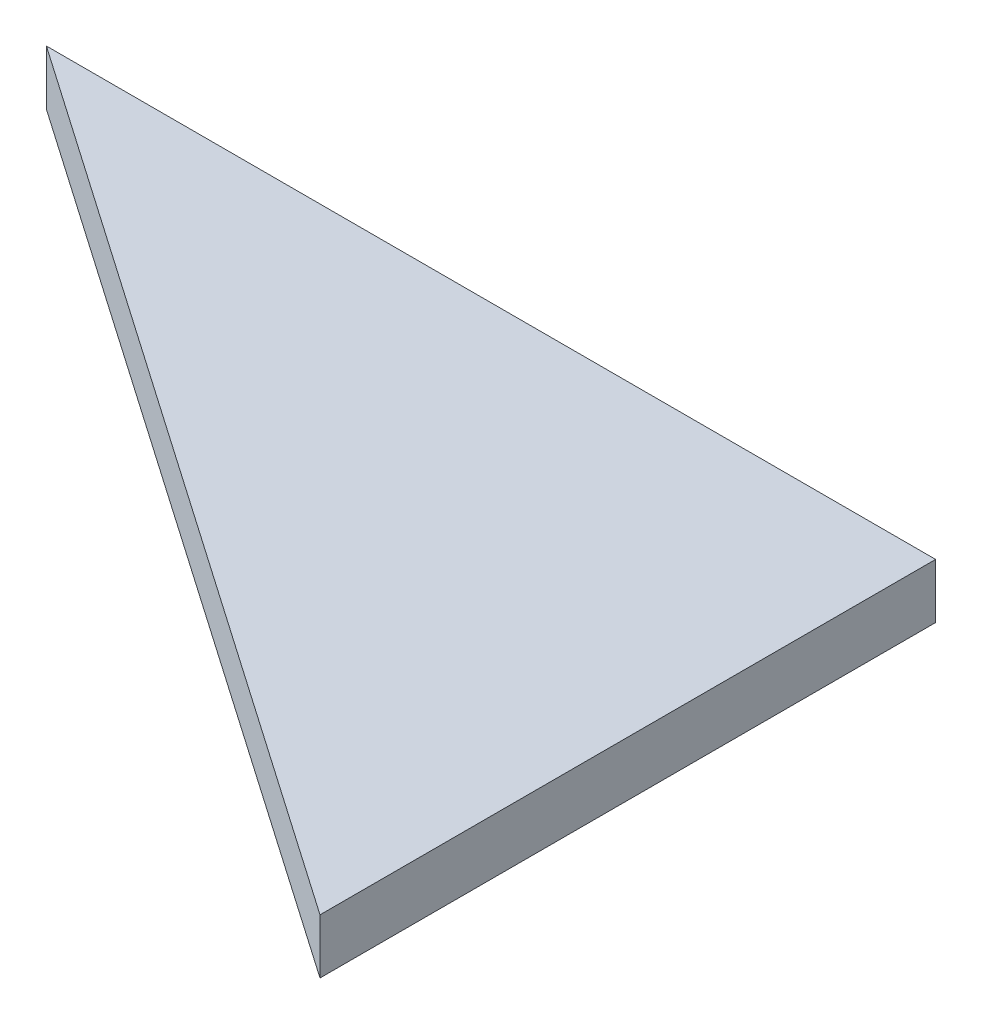
from build123d import *

# Parameters (mm, degrees)
BOSS_EXTRUDE1_DEPTH = 4


with BuildPart() as part:
    # Sketch1 → Boss-Extrude1 (new body)
    with BuildSketch(Plane(origin=(0, 0, 0), x_dir=(1, 0, 0), z_dir=(0, 1, 0))):
        Polygon((0, 0), (0, -45), (-65, 0), align=None)
    extrude(amount=BOSS_EXTRUDE1_DEPTH)


solid = part.part
